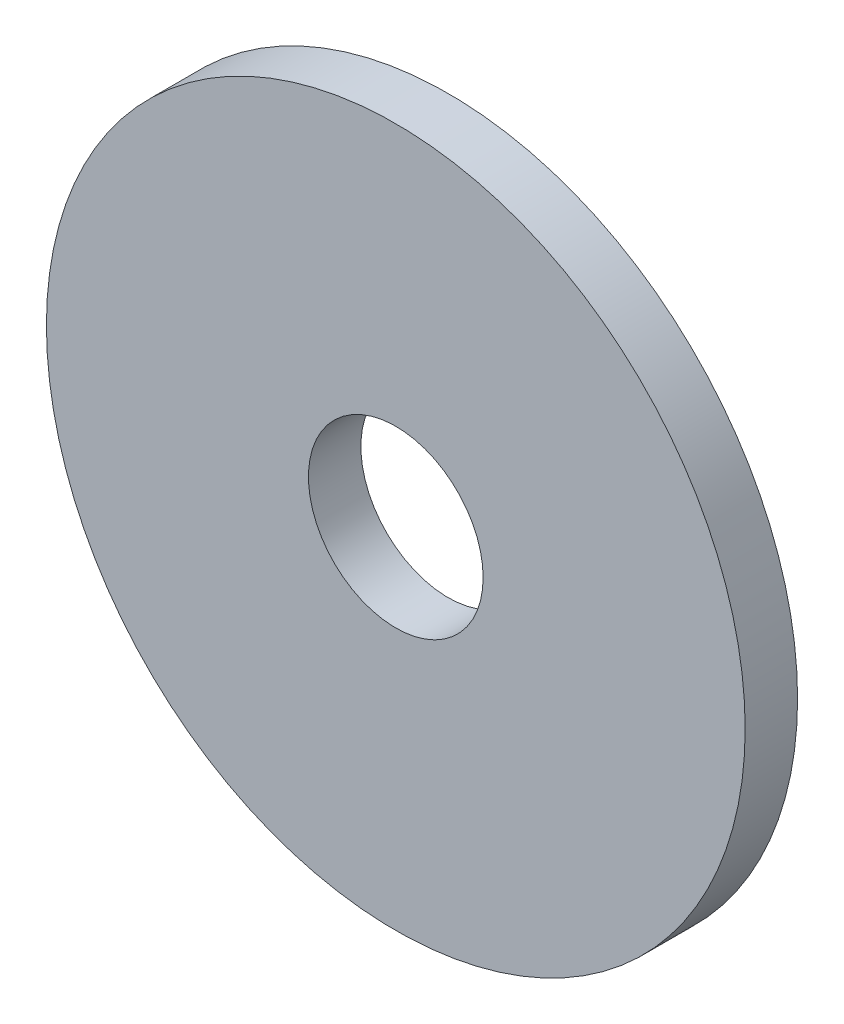
from build123d import *

# Parameters (mm, degrees)
SKETCH1_R           = 20
SKETCH1_R_2         = 5
BOSS_EXTRUDE1_DEPTH = 3


with BuildPart() as part:
    # Sketch1 → Boss-Extrude1 (new body)
    with BuildSketch(Plane.XY):
        with Locations((45, -11.5)):
            Circle(SKETCH1_R)
        with Locations((45, -11.5)):
            Circle(SKETCH1_R_2, mode=Mode.SUBTRACT)
    extrude(amount=-BOSS_EXTRUDE1_DEPTH)


solid = part.part
